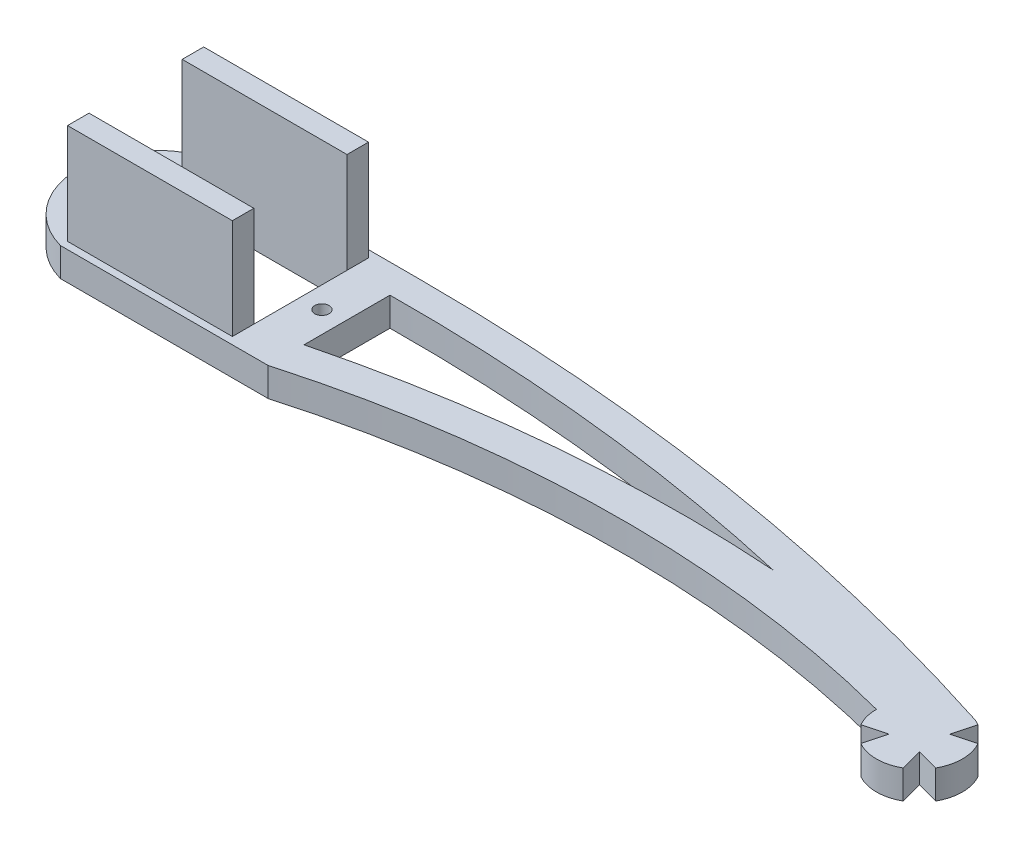
from build123d import *

# Parameters (mm, degrees)
EXTRUDE_1_DEPTH          = 2
EXTRUDE_2_DEPTH          = 4
CUT_EXTRUDE_1_DEPTH      = 115.638809515
CUT_EXTRUDE_1_DEPTH_BACK = 115.638809515
CUT_EXTRUDE_2_DEPTH      = 115.638809515
CUT_EXTRUDE_2_DEPTH_BACK = 115.638809515
SKETCH_5_R               = 1
SKETCH_6_W               = 23
SKETCH_6_H               = 3
EXTRUDE_3_DEPTH          = 14


with BuildPart() as part:
    # 草图1 → 凸台-拉伸1 (new, symmetric)
    with BuildSketch(Plane(origin=(0, 0, 0), x_dir=(1, 0, 0), z_dir=(0, 1, 0))):
        with BuildLine():
            Line((-11.5, -10.5), (17.5, -10.5))
            Line((17.5, -10.5), (17.5, 10.5))
            Line((17.5, 10.5), (-11.5, 10.5))
            ThreePointArc((-11.5, 10.5), (-19.5, 0), (-11.5, -10.5))
        make_face()
        Polygon((11.5, -6.5), (-11.5, -6.5), (-11.5, -3), (-12.5, -3), (-12.5, 3), (-11.5, 3), (-11.5, 6.5), (11.5, 6.5), align=None, mode=Mode.SUBTRACT)
    extrude(amount=EXTRUDE_1_DEPTH, both=True)

    # 草图2 → 凸台-拉伸2 (add)
    with BuildSketch(Plane(origin=(0, 2, 0), x_dir=(1, 0, 0), z_dir=(0, 1, 0))):
        with BuildLine():
            Line((17.5, -5.5), (17.5, -10.5))
            ThreePointArc((17.5, -10.5), (59.440835798, -4.44595009), (101.5, -9.614309047))
            ThreePointArc((101.5, -9.614309047), (111.034090536, -14.463041261), (109.336734694, -3.902356171))
            ThreePointArc((109.336734694, -3.902356171), (63.979602253, 6.877540604), (17.5, 10.5))
            Line((17.5, 10.5), (17.5, 6.5))
            ThreePointArc((17.5, 6.5), (47.689236459, 4.99679808), (77.5, 0))
            ThreePointArc((77.5, 0), (47.280596762, -0.356510126), (17.5, -5.5))
        make_face()
    extrude(amount=-EXTRUDE_2_DEPTH)

    # 草图4 → 切除-拉伸1 (cut, two sides: drawn at the far end of the back side and taken through both)
    with BuildSketch(Plane.XZ.offset(2).offset(-CUT_EXTRUDE_1_DEPTH_BACK)):
        with BuildLine():
            Line((102.276706609, 12.566800564), (105.378679656, 11.735629391))
            Line((105.378679656, 11.735629391), (104.547508484, 14.837602438))
            ThreePointArc((104.547508484, 14.837602438), (103.257359313, 13.856949735), (102.276706609, 12.566800564))
        make_face()
        with BuildLine():
            Line((110.452491516, 14.837602438), (109.621320344, 11.735629391))
            Line((109.621320344, 11.735629391), (112.723293391, 12.566800564))
            ThreePointArc((112.723293391, 12.566800564), (111.742640687, 13.856949735), (110.452491516, 14.837602438))
        make_face()
        with BuildLine():
            Line((112.723293391, 6.661817531), (109.621320344, 7.492988704))
            Line((109.621320344, 7.492988704), (110.452491516, 4.391015657))
            ThreePointArc((110.452491516, 4.391015657), (111.742640687, 5.37166836), (112.723293391, 6.661817531))
        make_face()
    extrude(amount=CUT_EXTRUDE_1_DEPTH + CUT_EXTRUDE_1_DEPTH_BACK, mode=Mode.SUBTRACT)

    # 草图5 → 切除-拉伸2 (cut, two sides: drawn at the far end of the back side and taken through both)
    with BuildSketch(Plane.XZ.offset(2).offset(-CUT_EXTRUDE_2_DEPTH_BACK)):
        with Locations(Location((14.5, 0, 0), (0, 0, 270))):
            Circle(SKETCH_5_R)
        with Locations(Location((-14.5, 0, 0), (0, 0, 270))):
            Circle(SKETCH_5_R)
    extrude(amount=CUT_EXTRUDE_2_DEPTH + CUT_EXTRUDE_2_DEPTH_BACK, mode=Mode.SUBTRACT)

    # 草图6 → 凸台-拉伸3 (add)
    with BuildSketch(Plane(origin=(0, 2, 0), x_dir=(1, 0, 0), z_dir=(0, 1, 0))):
        with Locations((0, -8)):
            Rectangle(SKETCH_6_W, SKETCH_6_H)
    extrude_3 = extrude(amount=EXTRUDE_3_DEPTH)

    # 镜向1: 凸台-拉伸3 across plane
    add(extrude_3.mirror(Plane.XY))


solid = part.part
